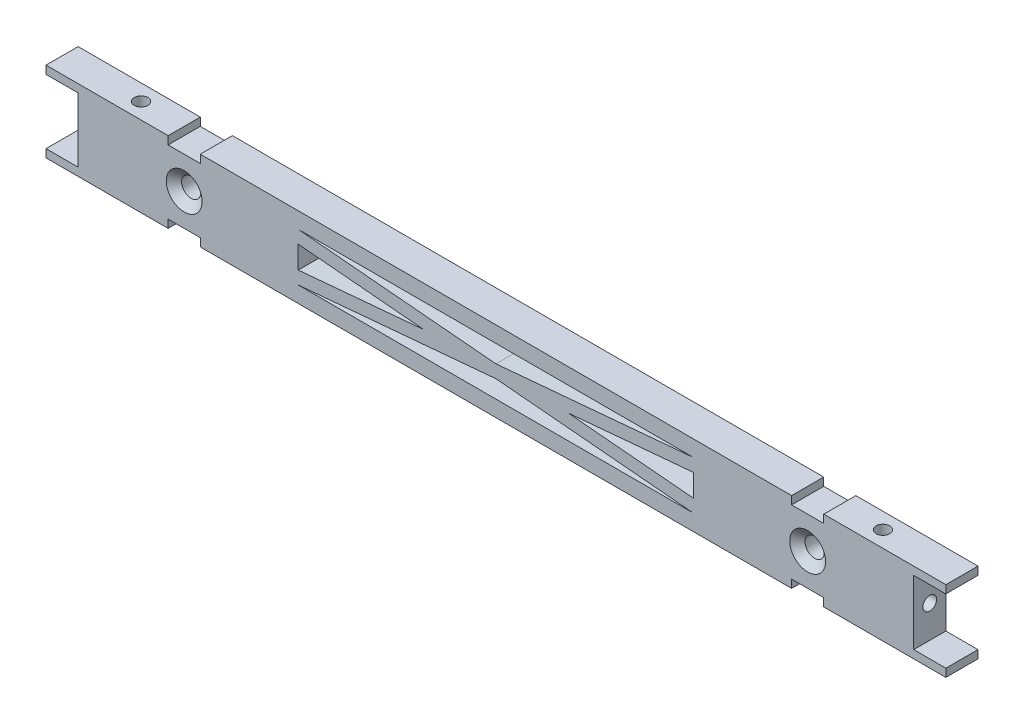
from build123d import *

# Parameters (mm, degrees)
BOSS_EXTRUDE1_DEPTH                               = 6.35
SKETCH7_W                                         = 6.35
SKETCH7_H                                         = 1.5875
CUT_EXTRUDE1_DEPTH                                = 90.479251261
CSK_FOR_6_FLAT_HEAD_MACHINE_SCREW_100_D           = 3.7973
CSK_FOR_6_FLAT_HEAD_MACHINE_SCREW_100_CSINK_D     = 7.0866
CSK_FOR_6_FLAT_HEAD_MACHINE_SCREW_100_CSINK_ANGLE = 100


with BuildPart() as part:
    # Sketch1 → Boss-Extrude1 (new body)
    with BuildSketch(Plane.XY):
        Polygon((-39.059416118, -2.212395735), (-39.059416118, 2.212395735), (-82.55, 6.095483582), (-82.55, -6.095483582), align=None)
        Polygon((39.059416118, -4.7625), (-39.059416118, -4.7625), (-74.619416118, -7.9375), (74.619416118, -7.9375), align=None)
        Polygon((-39.059416118, -4.7625), (-39.059416118, -2.212395735), (-82.55, -6.095483582), (-82.55, -6.35), (-85.400583882, -6.35), (-88.9, -6.662447868), (-88.9, -7.9375), (-74.619416118, -7.9375), align=None)
        Polygon((0, -1.275052132), (-14.280583882, 0), (-39.059416118, -2.212395735), (-39.059416118, -4.7625), align=None)
        Polygon((0, 1.275052132), (-39.059416118, 4.7625), (-39.059416118, 2.212395735), (-14.280583882, 0), align=None)
        Polygon((74.619416118, 7.9375), (-74.619416118, 7.9375), (-39.059416118, 4.7625), (39.059416118, 4.7625), align=None)
        Polygon((-74.619416118, 7.9375), (-88.9, 7.9375), (-88.9, 6.662447868), (-85.400583882, 6.35), (-82.55, 6.35), (-82.55, 6.095483582), (-39.059416118, 2.212395735), (-39.059416118, 4.7625), align=None)
        Polygon((39.059416118, -2.212395735), (14.280583882, 0), (0, -1.275052132), (39.059416118, -4.7625), align=None)
        Polygon((39.059416118, 2.212395735), (39.059416118, 4.7625), (0, 1.275052132), (14.280583882, 0), align=None)
        Polygon((14.280583882, 0), (0, 1.275052132), (-14.280583882, 0), (0, -1.275052132), align=None)
        Polygon((82.55, -6.095483582), (39.059416118, -2.212395735), (39.059416118, -4.7625), (74.619416118, -7.9375), (88.9, -7.9375), (88.9, -6.662447868), (85.400583882, -6.35), (82.55, -6.35), align=None)
        Polygon((88.9, 7.9375), (74.619416118, 7.9375), (39.059416118, 4.7625), (39.059416118, 2.212395735), (82.55, 6.095483582), (82.55, 6.35), (85.400583882, 6.35), (88.9, 6.662447868), align=None)
        Polygon((88.9, 6.35), (88.9, 6.662447868), (85.400583882, 6.35), align=None)
        Polygon((88.9, -6.35), (85.400583882, -6.35), (88.9, -6.662447868), align=None)
        Polygon((82.55, 6.095483582), (39.059416118, 2.212395735), (39.059416118, -2.212395735), (82.55, -6.095483582), align=None)
        Polygon((-88.9, -6.662447868), (-85.400583882, -6.35), (-88.9, -6.35), align=None)
        Polygon((-85.400583882, 6.35), (-88.9, 6.662447868), (-88.9, 6.35), align=None)
    extrude(amount=BOSS_EXTRUDE1_DEPTH)

    # Sketch4 → Tap Drill for #6-32 Tap1 (revolve, cut)
    with BuildSketch(Plane(origin=(-82.55, 0, 3.175), x_dir=(0, 0, 1), z_dir=(0, 1, 0))):
        Polygon((0, 0), (0, 13.51269403), (1.35255, 12.7), (1.35255, 0), align=None)
    tap_drill_for_6_32_tap1 = revolve(axis=Axis((-88.9, 0, 3.175), (1, 0, 0)), mode=Mode.SUBTRACT)

    # Mirror1: Tap Drill for #6-32 Tap1 across plane
    add(tap_drill_for_6_32_tap1.mirror(Plane(origin=(0, 0, 0), x_dir=(0, 0, 1), z_dir=(1, 0, 0))), mode=Mode.SUBTRACT)

    # Sketch5 → Tap Drill for #6-32 Tap2 (revolve, cut)
    with BuildSketch(Plane(origin=(-73.289583418, 7.9375, 3.175), x_dir=(0, 0, 1), z_dir=(1, 0, 0))):
        Polygon((0, 0), (0, 7.16269403), (1.35255, 6.35), (1.35255, 0), align=None)
    tap_drill_for_6_32_tap2 = revolve(axis=Axis((-73.289583418, 14.2875, 3.175), (0, -1, 0)), mode=Mode.SUBTRACT)

    # Mirror2: Tap Drill for #6-32 Tap2 across plane
    add(tap_drill_for_6_32_tap2.mirror(Plane(origin=(0, 0, 0), x_dir=(0, 0, 1), z_dir=(1, 0, 0))), mode=Mode.SUBTRACT)

    # Mirror3: Tap Drill for #6-32 Tap2 across plane
    add(tap_drill_for_6_32_tap2.mirror(Plane(origin=(0, 0, 0), x_dir=(0, 0, 1), z_dir=(0, -1, 0))), mode=Mode.SUBTRACT)

    # Mirror3 copy 1 sketch → Mirror3 copy 1 (revolve, cut)
    with BuildSketch(Plane(origin=(73.289583418, -7.9375, 3.175), x_dir=(0, 0, 1), z_dir=(-1, 0, 0))):
        Polygon((0, 0), (0, 7.16269403), (1.35255, 6.35), (1.35255, 0), align=None)
    revolve(axis=Axis((73.289583418, -14.2875, 3.175), (0, 1, 0)), mode=Mode.SUBTRACT)

    # Sketch7 → Cut-Extrude1 (cut, through all)
    with BuildSketch(Plane.XY.offset(6.35)):
        with Locations((-61.595, 7.14375)):
            Rectangle(SKETCH7_W, SKETCH7_H)
        with Locations((-61.595, -7.14375)):
            Rectangle(SKETCH7_W, SKETCH7_H)
        with Locations((61.595, -7.14375)):
            Rectangle(SKETCH7_W, SKETCH7_H)
        with Locations((61.595, 7.14375)):
            Rectangle(SKETCH7_W, SKETCH7_H)
    extrude(amount=-CUT_EXTRUDE1_DEPTH, mode=Mode.SUBTRACT)

    # CSK for #6 Flat Head Machine Screw (100)1 (through all)
    with Locations(Plane.XY.offset(6.35)):
        with Locations((-61.595, 0), (61.595, 0)):
            CounterSinkHole(CSK_FOR_6_FLAT_HEAD_MACHINE_SCREW_100_D / 2, CSK_FOR_6_FLAT_HEAD_MACHINE_SCREW_100_CSINK_D / 2, counter_sink_angle=CSK_FOR_6_FLAT_HEAD_MACHINE_SCREW_100_CSINK_ANGLE)


solid = part.part
